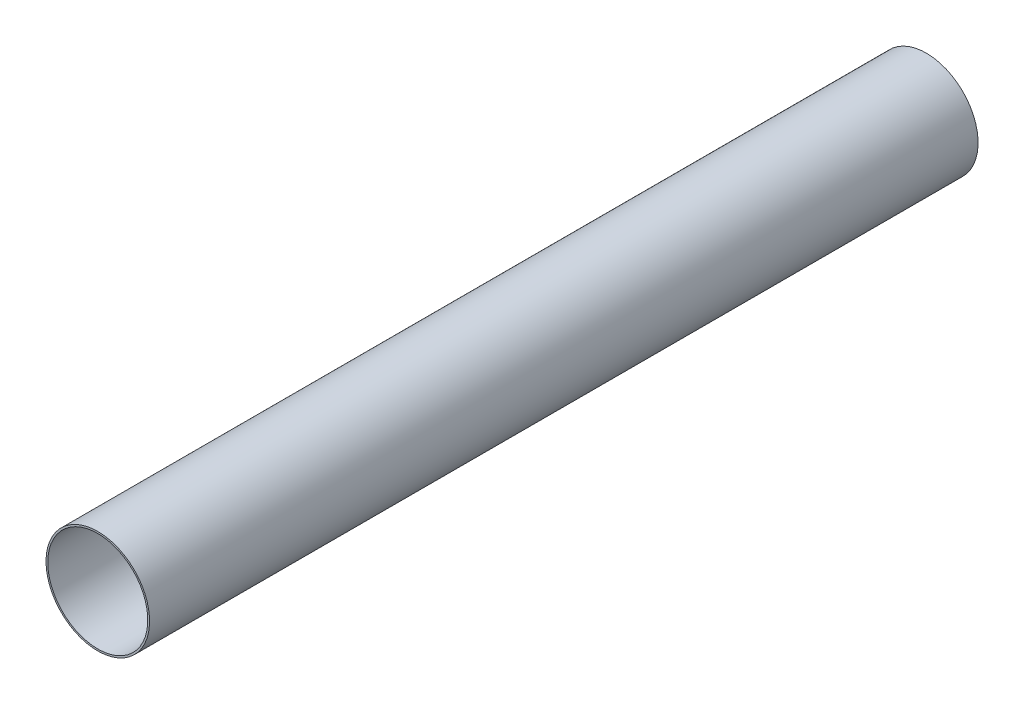
from build123d import *

# Parameters (mm, degrees)
ESQUISSE1_R        = 76.2
ESQUISSE1_R_2      = 73.6092
BOSS_EXTRU_1_DEPTH = 1219.2


with BuildPart() as part:
    # Esquisse1 → Boss.-Extru.1 (new body)
    with BuildSketch(Plane.XY):
        with Locations(Location((0, 0, 0), (0, 0, 180))):
            Circle(ESQUISSE1_R)
        with Locations(Location((0, 0, 0), (0, 0, 180))):
            Circle(ESQUISSE1_R_2, mode=Mode.SUBTRACT)
    extrude(amount=BOSS_EXTRU_1_DEPTH)


solid = part.part
